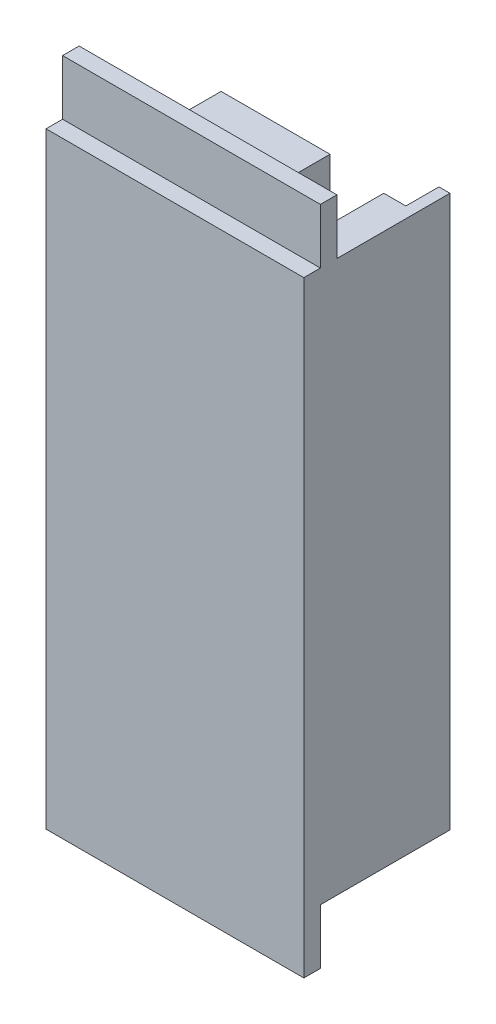
from build123d import *

# Parameters (mm, degrees)
BOSS_EXTRUDE1_DEPTH = 100
SKETCH2_W           = 46.75
SKETCH2_H           = 3
BOSS_EXTRUDE2_DEPTH = 10
SKETCH3_W           = 46.75
SKETCH3_H           = 3
BOSS_EXTRUDE3_DEPTH = 10


with BuildPart() as part:
    # Sketch1 → Boss-Extrude1 (new body)
    with BuildSketch(Plane(origin=(0, 0, 0), x_dir=(1, 0, 0), z_dir=(0, 1, 0))):
        Polygon((0, 6), (0, 0), (-15, 0), (-15, -6), (4.875, -6), (4.875, 15.75), (-5, 15.75), (-5, 6), align=None)
        Polygon((4.875, 15.75), (4.875, -6), (24.75, -6), (31.75, -6), (31.75, 20.5), (29.75, 20.5), (29.75, 14.5), (25.75, 14.5), (25.75, 0), (9.75, 0), (9.75, 6), (14.75, 6), (14.75, 15.75), align=None)
    extrude(amount=BOSS_EXTRUDE1_DEPTH)

    # Sketch2 → Boss-Extrude2 (add)
    with BuildSketch(Plane.XZ):
        with Locations((8.375, 4.5)):
            Rectangle(SKETCH2_W, SKETCH2_H)
    extrude(amount=BOSS_EXTRUDE2_DEPTH)

    # Sketch3 → Boss-Extrude3 (add)
    with BuildSketch(Plane(origin=(0, 100, 0), x_dir=(1, 0, 0), z_dir=(0, 1, 0))):
        with Locations((8.375, -1.5)):
            Rectangle(SKETCH3_W, SKETCH3_H)
    extrude(amount=BOSS_EXTRUDE3_DEPTH)


solid = part.part
